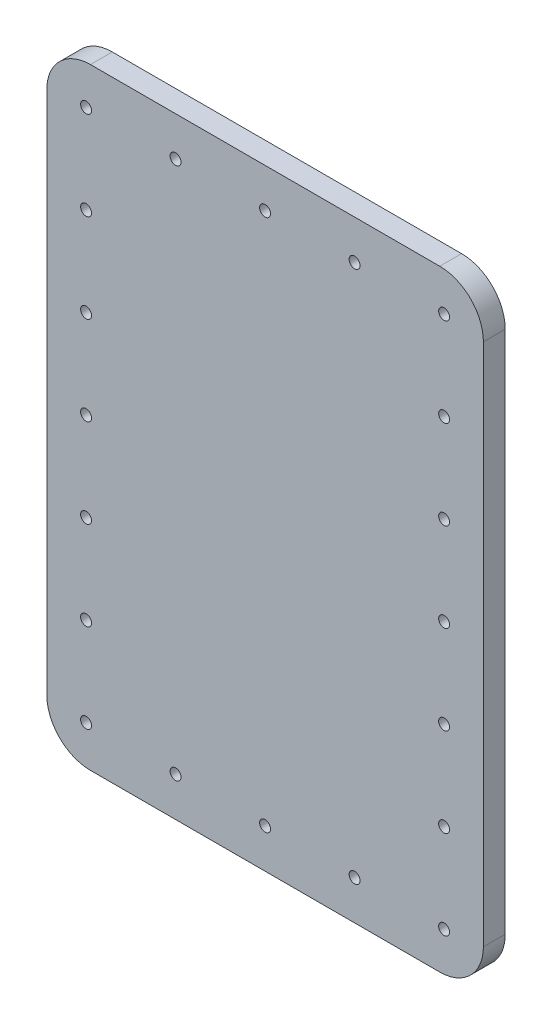
from build123d import *

# Parameters (mm, degrees)
SKETCH1_W           = 100
SKETCH1_H           = 140
SKETCH1_R           = 1.25
BOSS_EXTRUDE1_DEPTH = 5
FILLET1_R           = 10


with BuildPart() as part:
    # Sketch1 → Boss-Extrude1 (new body)
    with BuildSketch(Plane.XY):
        Rectangle(SKETCH1_W, SKETCH1_H)
        with Locations((0, 61)):
            Circle(SKETCH1_R, mode=Mode.SUBTRACT)
        with Locations((-41, 61)):
            Circle(SKETCH1_R, mode=Mode.SUBTRACT)
        with Locations((-20.5, 61)):
            Circle(SKETCH1_R, mode=Mode.SUBTRACT)
        with Locations((20.5, 61)):
            Circle(SKETCH1_R, mode=Mode.SUBTRACT)
        with Locations((41, 61)):
            Circle(SKETCH1_R, mode=Mode.SUBTRACT)
        with Locations((-41, 0)):
            Circle(SKETCH1_R, mode=Mode.SUBTRACT)
        with Locations((-41, 40.666666667)):
            Circle(SKETCH1_R, mode=Mode.SUBTRACT)
        with Locations((-41, 20.333333333)):
            Circle(SKETCH1_R, mode=Mode.SUBTRACT)
        with Locations(Location((41, 40.666666667, 0), (0, 0, 180))):
            Circle(SKETCH1_R, mode=Mode.SUBTRACT)
        with Locations(Location((41, 20.333333333, 0), (0, 0, 180))):
            Circle(SKETCH1_R, mode=Mode.SUBTRACT)
        with Locations(Location((41, 0, 0), (0, 0, 180))):
            Circle(SKETCH1_R, mode=Mode.SUBTRACT)
        with Locations(Location((-20.5, -61, 0), (0, 0, 180))):
            Circle(SKETCH1_R, mode=Mode.SUBTRACT)
        with Locations(Location((0, -61, 0), (0, 0, 180))):
            Circle(SKETCH1_R, mode=Mode.SUBTRACT)
        with Locations(Location((20.5, -61, 0), (0, 0, 180))):
            Circle(SKETCH1_R, mode=Mode.SUBTRACT)
        with Locations(Location((41, -61, 0), (0, 0, 180))):
            Circle(SKETCH1_R, mode=Mode.SUBTRACT)
        with Locations((41, -40.666666667)):
            Circle(SKETCH1_R, mode=Mode.SUBTRACT)
        with Locations((41, -20.333333333)):
            Circle(SKETCH1_R, mode=Mode.SUBTRACT)
        with Locations(Location((-41, -20.333333333, 0), (0, 0, 180))):
            Circle(SKETCH1_R, mode=Mode.SUBTRACT)
        with Locations(Location((-41, -40.666666667, 0), (0, 0, 180))):
            Circle(SKETCH1_R, mode=Mode.SUBTRACT)
        with Locations(Location((-41, -61, 0), (0, 0, 180))):
            Circle(SKETCH1_R, mode=Mode.SUBTRACT)
    extrude(amount=BOSS_EXTRUDE1_DEPTH)

    # Fillet1
    fillet1_edges = [part.edges().sort_by_distance(p)[0] for p in [
        (50, -70, 2.5),
        (-50, -70, 2.5),
        (-50, 70, 2.5),
        (50, 70, 2.5),
    ]]
    fillet(fillet1_edges, radius=FILLET1_R)


solid = part.part
